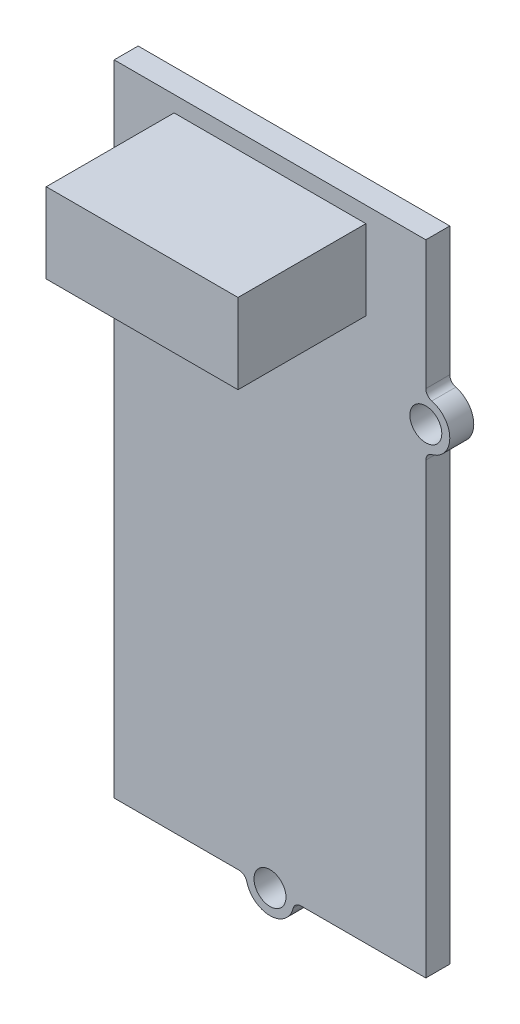
from build123d import *

# Parameters (mm, degrees)
SKETCH_1_W          = 19.5
SKETCH_1_H          = 40
EXTRUDE_1_DEPTH     = 1.5
SKETCH_2_R          = 1.5
EXTRUDE_2_DEPTH     = 1.5
SKETCH_3_R          = 1
CUT_EXTRUDE_1_DEPTH = 1.5
FILLET_1_R          = 0.5
SKETCH_4_W          = 12
SKETCH_4_H          = 5
EXTRUDE_3_DEPTH     = 8


with BuildPart() as part:
    # ｽｹｯﾁ1 → ﾎﾞｽ - 押し出し1 (new body)
    with BuildSketch(Plane.XY):
        Rectangle(SKETCH_1_W, SKETCH_1_H)
    extrude(amount=EXTRUDE_1_DEPTH)

    # ｽｹｯﾁ2 → ﾎﾞｽ - 押し出し2 (add)
    with BuildSketch(Plane.XY.offset(1.5)):
        with Locations((9.75, 10)):
            Circle(SKETCH_2_R)
        with Locations((-9.75, 10)):
            Circle(SKETCH_2_R)
        with Locations((0, -20)):
            Circle(SKETCH_2_R)
    extrude(amount=-EXTRUDE_2_DEPTH)

    # ｽｹｯﾁ3 → ｶｯﾄ - 押し出し1 (cut)
    with BuildSketch(Plane.XY.offset(1.5)):
        with Locations((-9.75, 10)):
            Circle(SKETCH_3_R)
        with Locations((9.75, 10)):
            Circle(SKETCH_3_R)
        with Locations((0, -20)):
            Circle(SKETCH_3_R)
    extrude(amount=-CUT_EXTRUDE_1_DEPTH, mode=Mode.SUBTRACT)

    # ﾌｨﾚｯﾄ1
    fillet_1_edges = [part.edges().sort_by_distance(p)[0] for p in [
        (9.75, 8.5, 0.75),
        (9.75, 11.5, 0.75),
        (-9.75, 11.5, 0.75),
        (-9.75, 8.5, 0.75),
        (-1.5, -20, 0.75),
        (1.5, -20, 0.75),
    ]]
    fillet(fillet_1_edges, radius=FILLET_1_R)

    # ｽｹｯﾁ4 → ﾎﾞｽ - 押し出し3 (add)
    with BuildSketch(Plane.XY.offset(1.5)):
        with Locations((0, 16.5)):
            Rectangle(SKETCH_4_W, SKETCH_4_H)
    extrude(amount=EXTRUDE_3_DEPTH)


solid = part.part
